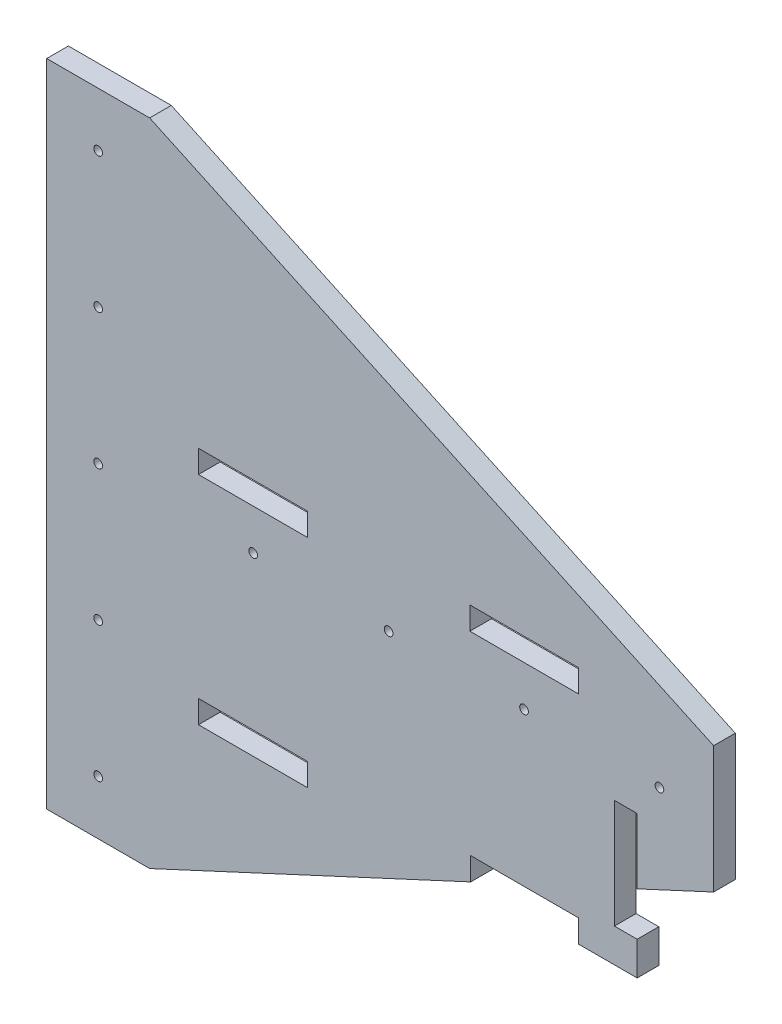
from build123d import *

# Parameters (mm, degrees)
SKETCH1_W           = 20.1
SKETCH1_H           = 4.2
BOSS_EXTRUDE1_DEPTH = 4
SKETCH2_R           = 0.8
CUT_EXTRUDE1_DEPTH  = 4
SKETCH2_3_R         = 0.8
CUT_EXTRUDE2_DEPTH  = 4
LPATTERN1_COUNT     = 6
LPATTERN1_PITCH     = 25
LPATTERN2_COUNT     = 4
LPATTERN2_PITCH     = 25


with BuildPart() as part:
    # Sketch1 → Boss-Extrude1 (new body)
    with BuildSketch(Plane.XY):
        Polygon((-63.114700901, 60), (-63.114700901, -60), (-44.114700901, -60), (15.164047805, -32.5), (15.164047805, -28.3), (35.1, -28.3), (35.1, -32.5), (45.885299099, -32.5), (45.885299099, -26.3), (41.685299099, -26.3), (41.685299099, -6.2), (45.885299099, -6.2), (45.885299099, -8.64710736), (45.885299099, -18.248106547), (60.000337735, -11.7), (60.000337735, 11.7), (-44.114700901, 60), align=None)
        with Locations((-25.05, -30.4)):
            Rectangle(SKETCH1_W, SKETCH1_H, mode=Mode.SUBTRACT)
        with Locations((25.05, 9.6)):
            Rectangle(SKETCH1_W, SKETCH1_H, mode=Mode.SUBTRACT)
        with Locations((-25.05, 9.6)):
            Rectangle(SKETCH1_W, SKETCH1_H, mode=Mode.SUBTRACT)
    extrude(amount=BOSS_EXTRUDE1_DEPTH)

    # Sketch2 → Cut-Extrude1 (cut)
    with BuildSketch(Plane.XY.offset(4)):
        with Locations((-53.614700901, 50)):
            Circle(SKETCH2_R)
    cut_extrude1 = extrude(amount=-CUT_EXTRUDE1_DEPTH, mode=Mode.SUBTRACT)

    # Sketch2<3> → Cut-Extrude2 (cut)
    with BuildSketch(Plane.XY.offset(4)):
        with Locations((50.000337735, 0)):
            Circle(SKETCH2_3_R)
    cut_extrude2 = extrude(amount=-CUT_EXTRUDE2_DEPTH, mode=Mode.SUBTRACT)

    # LPattern1: Cut-Extrude1 ×6
    with Locations(*[(0, -i * LPATTERN1_PITCH, 0) for i in range(1, LPATTERN1_COUNT)]):
        add(cut_extrude1, mode=Mode.SUBTRACT)

    # LPattern2: Cut-Extrude2 ×4
    with Locations(*[(-i * LPATTERN2_PITCH, 0, 0) for i in range(1, LPATTERN2_COUNT)]):
        add(cut_extrude2, mode=Mode.SUBTRACT)


solid = part.part
